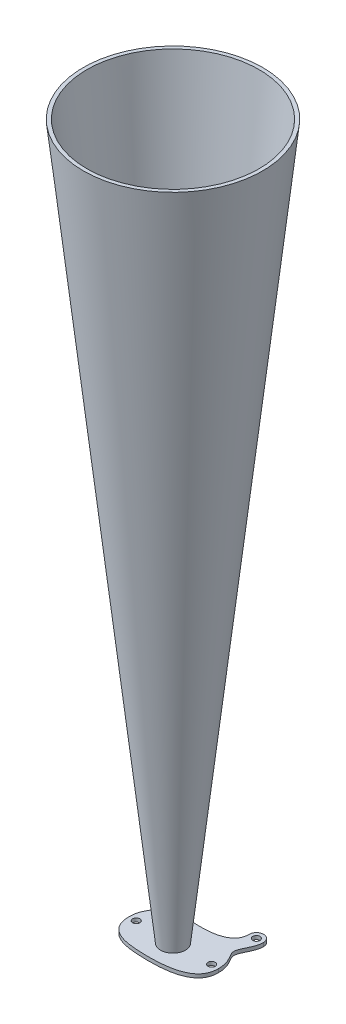
from build123d import *

# Parameters (mm, degrees)
SKETCH1_R           = 25
BOSS_EXTRUDE1_DEPTH = 200
SHELL1_T            = -1
SKETCH4_W           = 1
SKETCH4_H           = 1
BOSS_EXTRUDE2_DEPTH = 1
SKETCH5_R           = 1
SKETCH5_R_2         = 3.35
BOSS_EXTRUDE3_DEPTH = 1


with BuildPart() as part:
    # Sketch1 → Boss-Extrude1 (new body)
    with BuildSketch(Plane(origin=(0, 0, 0), x_dir=(1, 0, 0), z_dir=(0, 1, 0))):
        with Locations(Location((0, 0, 0), (0, 0, 270))):
            Circle(SKETCH1_R)
    extrude(amount=BOSS_EXTRUDE1_DEPTH)

    # Sketch2 → Cut-Revolve1 (revolve, cut)
    with BuildSketch(Plane.XY, mode=Mode.PRIVATE) as cut_revolve1_sk:
        Polygon((-25, 200), (-3.35, 0), (-25, 0), align=None)
    revolve(cut_revolve1_sk.sketch.rotate(Axis((0, 0, 0), (0, 1, 0)), 90), axis=Axis((0, 0, 0), (0, 1, 0)), mode=Mode.SUBTRACT)

    # Shell1
    shell1_openings = [part.faces().sort_by_distance(p)[0] for p in [
        (0, 200, 0),
        (0, 0, 0),
    ]]
    offset(amount=SHELL1_T, openings=shell1_openings, kind=Kind.INTERSECTION)

    # Sketch5 → Boss-Extrude3 (add)
    with BuildSketch(Plane.XZ):
        with BuildLine():
            add(Edge.make_bspline(
                [(-12.5, -12.75), (-12.5, -10.276529653), (-8.5, -5.918139103), (-12.5, -3.88719214), (-12.5, -0.25)],
                knots=[0, 0, 0, 0, 0.5, 1, 1, 1, 1], degree=3))
            ThreePointArc((-12.5, -12.75), (-10.5, -14.75), (-8.5, -12.75))
            add(Edge.make_bspline(
                [(-8.5, -12.75), (-8.5, -8.812678575), (-0.936323636, -6.901749471), (8.551571166, -8.386496121), (8.501401516, -12.675139452)],
                knots=[0, 0, 0, 0, 0.45, 0.996833123, 0.996833123, 0.996833123, 0.996833123], degree=3))
            add(Edge.make_bspline(
                [(8.501401516, -12.675139452), (8.501110969, -12.699976289), (8.500644174, -12.724929646), (8.5, -12.75)],
                knots=[0.996833123, 0.996833123, 0.996833123, 0.996833123, 1, 1, 1, 1], degree=3))
            ThreePointArc((8.5, -12.75), (10.5, -14.75), (12.5, -12.75))
            add(Edge.make_bspline(
                [(12.5, -12.75), (12.5, -10.276529653), (8.5, -5.918139103), (12.5, -3.88719214), (12.5, -0.25)],
                knots=[0, 0, 0, 0, 0.5, 1, 1, 1, 1], degree=3))
            add(Edge.make_bspline(
                [(-12.5, -0.25), (-12.5, 5.628170091), (-1.338084599, 7.628919255), (12.65819275, 6.1139914), (12.5, -0.25)],
                knots=[0, 0, 0, 0, 0.45, 1, 1, 1, 1], degree=3))
        make_face()
        with Locations(Location((-10.5, -12.75, 0), (0, 0, 270))):
            Circle(SKETCH5_R, mode=Mode.SUBTRACT)
        with Locations(Location((10.5, -12.75, 0), (0, 0, 270))):
            Circle(SKETCH5_R, mode=Mode.SUBTRACT)
        with Locations(Location((-10.5, -0.25, 0), (0, 0, 270))):
            Circle(SKETCH5_R, mode=Mode.SUBTRACT)
        Circle(SKETCH5_R_2, mode=Mode.SUBTRACT)
        with Locations(Location((10.5, -0.25, 0), (0, 0, 270))):
            Circle(SKETCH5_R, mode=Mode.SUBTRACT)
    extrude(amount=-BOSS_EXTRUDE3_DEPTH)


with BuildPart() as body_2:
    # Sketch4 → Boss-Extrude2 (new body)
    with BuildSketch(Plane.XZ):
        Rectangle(SKETCH4_W, SKETCH4_H)
    extrude(amount=-BOSS_EXTRUDE2_DEPTH)


solid = Compound([part.part, body_2.part])
